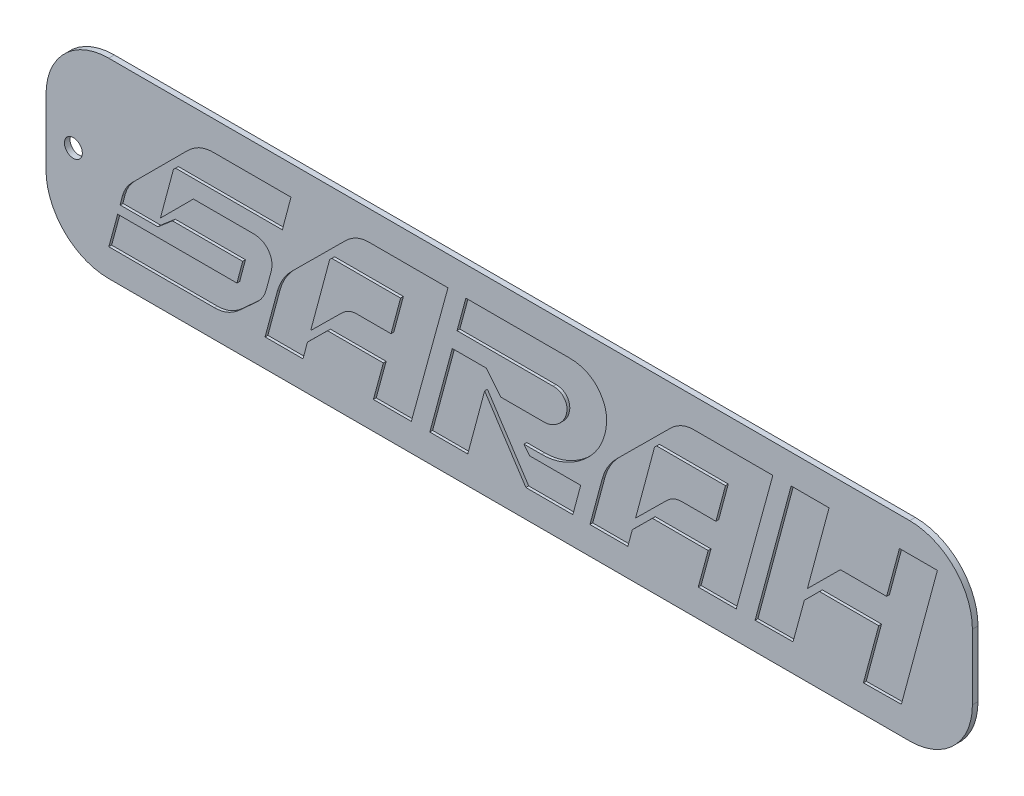
from build123d import *

# Parameters (mm, degrees)
SKETCH1_R           = 5.08
BOSS_EXTRUDE1_DEPTH = 3.175
CUT_EXTRUDE1_DEPTH  = 1.5875


with BuildPart() as part:
    # Sketch1 → Boss-Extrude1 (new body)
    with BuildSketch(Plane.XY):
        with BuildLine():
            Line((-8.106859286, 92.66093554), (446.032681403, 92.66093554))
            ThreePointArc((446.032681403, 92.66093554), (471.177398542, 82.245652679), (481.592681403, 57.10093554))
            Line((481.592681403, 57.10093554), (481.592681403, 19.985636247))
            ThreePointArc((481.592681403, 19.985636247), (471.177398542, -5.159080892), (446.032681403, -15.574363753))
            Line((446.032681403, -15.574363753), (-8.106859286, -15.574363753))
            ThreePointArc((-8.106859286, -15.574363753), (-33.251576425, -5.159080892), (-43.666859286, 19.985636247))
            Line((-43.666859286, 19.985636247), (-43.666859286, 57.10093554))
            ThreePointArc((-43.666859286, 57.10093554), (-33.251576425, 82.245652679), (-8.106859286, 92.66093554))
        make_face()
        with Locations((-28.147827402, 38.543285894)):
            Circle(SKETCH1_R, mode=Mode.SUBTRACT)
    extrude(amount=BOSS_EXTRUDE1_DEPTH)

    # Sketch2 → Cut-Extrude1 (cut)
    # profile 1 of 5: a face of its own
    with BuildSketch(Plane.XY.offset(3.175)):
        with BuildLine():
            Line((29.787987616, 57.61003096), (28.592693498, 56.414736842))
            Line((28.592693498, 56.414736842), (21.200743034, 28.812879257))
            Line((21.200743034, 28.812879257), (39.900804954, 47.512941176))
            Line((39.900804954, 47.512941176), (73.809411765, 47.512941176))
            add(Edge.make_bspline(
                [(73.809411765, 47.512941176), (74.276696684, 47.501766075), (75.183851137, 47.48007151), (76.50174546, 47.285971092), (77.732350114, 46.976039182), (78.875055153, 46.534991188), (79.924614884, 45.96044611), (80.890215533, 45.267458165), (81.761446059, 44.44107263), (82.529307713, 43.497628674), (83.18041765, 42.464319214), (83.728879869, 41.380361786), (84.101737545, 40.227178597), (84.359316183, 39.026157644), (84.465299782, 37.763754748), (84.430461445, 36.45143263), (84.257305067, 35.086176719), (84.036184999, 34.174162182), (83.922229102, 33.704148607)],
                knots=[0, 0, 0, 0, 1.109102603, 2.153134682, 3.15559003, 4.117330611, 5.053263289, 5.989609858, 6.931896307, 7.89629219, 8.870203132, 9.827825582, 10.772657979, 11.739541594, 12.739287703, 13.772876215, 14.852234947, 16, 16, 16, 16], degree=3))
            Line((83.922229102, 33.704148607), (81.201362229, 23.591331269))
            add(Edge.make_bspline(
                [(81.201362229, 23.591331269), (80.948807094, 22.773977955), (80.44238627, 21.135029938), (79.213300767, 18.835721083), (77.627937742, 16.68308216), (76.329649623, 15.426794211), (75.665263158, 14.783900929)],
                knots=[0, 0, 0, 0, 0.971370715, 1.947782042, 2.949797186, 4, 4, 4, 4], degree=3))
            Line((75.665263158, 14.783900929), (66.102910217, 6.086563467))
            add(Edge.make_bspline(
                [(66.102910217, 6.086563467), (65.560841254, 5.609432536), (64.496417328, 4.672523), (62.783592859, 3.470844922), (61.057698565, 2.411305402), (59.266208972, 1.587695377), (57.453479987, 0.906167515), (55.581781266, 0.462791196), (53.677351872, 0.1626132), (52.389644087, 0.127638347), (51.743653251, 0.110092879)],
                knots=[0, 0, 0, 0, 1.087244962, 2.13494893, 3.148231978, 4.134112956, 5.101176401, 6.060986606, 7.027275522, 8, 8, 8, 8], degree=3))
            Line((51.743653251, 0.110092879), (-8.036780186, 0.110092879))
            Line((-8.036780186, 0.110092879), (-3.035417957, 18.58996904))
            Line((-3.035417957, 18.58996904), (64.577337461, 18.58996904))
            Line((64.577337461, 18.58996904), (67.832941176, 30.873188854))
            Line((67.832941176, 30.873188854), (28.042229102, 30.873188854))
            Line((28.042229102, 30.873188854), (19.785263158, 23.811517028))
            Line((19.785263158, 23.811517028), (-1.635665635, 23.811517028))
            Line((-1.635665635, 23.811517028), (-0.330278638, 28.922972136))
            add(Edge.make_bspline(
                [(-0.330278638, 28.922972136), (-0.06215412, 29.782442048), (0.47671499, 31.509780492), (1.76072826, 33.940333075), (3.352486907, 36.272094833), (4.661439518, 37.663046321), (5.331640867, 38.375232198)],
                knots=[0, 0, 0, 0, 0.968000833, 1.945460836, 2.948048303, 4, 4, 4, 4], degree=3))
            Line((5.331640867, 38.375232198), (36.535108359, 69.57869969))
            add(Edge.make_bspline(
                [(36.535108359, 69.57869969), (37.076053449, 70.098080057), (38.137751895, 71.117454), (39.859750727, 72.431201221), (41.618884683, 73.562705838), (43.428997761, 74.502485662), (45.306639283, 75.207008054), (47.230368657, 75.710962009), (49.199870157, 76.044764426), (50.536522058, 76.074798612), (51.208916409, 76.089907121)],
                knots=[0, 0, 0, 0, 1.090484129, 2.140264008, 3.14544098, 4.131445471, 5.1019832, 6.056773183, 7.022471944, 8, 8, 8, 8], degree=3))
            Line((51.208916409, 76.089907121), (95.230340557, 76.089907121))
            Line((95.230340557, 76.089907121), (90.339071207, 57.61003096))
            Line((90.339071207, 57.61003096), (29.787987616, 57.61003096))
        make_face()
    # profile 2 of 5: a face of its own
    with BuildSketch(Plane.XY.offset(3.175)):
        with BuildLine():
            Line((139.45622291, 76.089907121), (184.248297214, 76.089907121))
            Line((184.248297214, 76.089907121), (163.472198142, 0.110092879))
            Line((163.472198142, 0.110092879), (141.956904025, 0.110092879))
            Line((141.956904025, 0.110092879), (147.603095975, 20.870464396))
            Line((147.603095975, 20.870464396), (115.97498452, 20.870464396))
            Line((115.97498452, 20.870464396), (104.556780186, 9.562352941))
            Line((104.556780186, 9.562352941), (102.056099071, 0.110092879))
            Line((102.056099071, 0.110092879), (80.540804954, 0.110092879))
            Line((80.540804954, 0.110092879), (87.492383901, 25.981919505))
            add(Edge.make_bspline(
                [(87.492383901, 25.981919505), (87.688035338, 26.645371072), (88.079006166, 27.971148241), (88.824916675, 29.910929371), (89.702576211, 31.800461991), (90.737357753, 33.634395292), (91.896945565, 35.421190898), (93.189051588, 37.159516171), (94.630544536, 38.829815678), (95.665268216, 39.895431078), (96.189721362, 40.435541796)],
                knots=[0, 0, 0, 0, 0.972188851, 1.942727767, 2.918792729, 3.89888478, 4.900660299, 5.911935627, 6.941657613, 8, 8, 8, 8], degree=3))
            Line((96.189721362, 40.435541796), (126.197894737, 70.223529412))
            add(Edge.make_bspline(
                [(126.197894737, 70.223529412), (126.693738362, 70.68811599), (127.667249793, 71.600259095), (129.228355243, 72.799594193), (130.839256509, 73.806711452), (132.476815777, 74.649150324), (134.161747858, 75.305189439), (135.893002624, 75.757242357), (137.664989023, 76.032176586), (138.857615621, 76.07061432), (139.45622291, 76.089907121)],
                knots=[0, 0, 0, 0, 1.09520327, 2.15026038, 3.168190723, 4.15492977, 5.115689715, 6.0773418, 7.034972711, 8, 8, 8, 8], degree=3))
        make_face()
        with BuildLine():
            Line((151.959628483, 37.400123839), (157.385634675, 57.61003096))
            Line((157.385634675, 57.61003096), (118.365572755, 57.61003096))
            Line((118.365572755, 57.61003096), (117.170278638, 56.414736842))
            Line((117.170278638, 56.414736842), (106.412631579, 16.199380805))
            Line((106.412631579, 16.199380805), (123.901671827, 33.483962848))
            add(Edge.make_bspline(
                [(123.901671827, 33.483962848), (124.227130622, 33.793484328), (124.866595681, 34.401635574), (125.890867818, 35.204466573), (126.950415514, 35.892296283), (128.047201798, 36.433077589), (129.164570187, 36.874999281), (130.31794362, 37.163848907), (131.501525727, 37.365984392), (132.30456566, 37.388687169), (132.709102167, 37.400123839)],
                knots=[0, 0, 0, 0, 1.088018936, 2.137751703, 3.149265309, 4.143636785, 5.096896491, 6.055307392, 7.020348651, 8, 8, 8, 8], degree=3))
            Line((132.709102167, 37.400123839), (151.959628483, 37.400123839))
        make_face(mode=Mode.SUBTRACT)
    # profile 3 of 5: a face of its own
    with BuildSketch(Plane.XY.offset(3.175)):
        with BuildLine():
            add(Edge.make_bspline(
                [(270.262291022, 68.053126935), (270.731488529, 67.366880996), (271.661761032, 66.00626906), (272.728765108, 63.778867775), (273.519576616, 61.455712397), (274.03233301, 59.021807131), (274.225924849, 56.475326223), (274.140889545, 53.824684264), (273.778705596, 51.062974752), (273.32633654, 49.218328433), (273.093250774, 48.267863777)],
                knots=[0, 0, 0, 0, 0.961877665, 1.907103789, 2.850083582, 3.799378563, 4.780335239, 5.801073342, 6.866990356, 8, 8, 8, 8], degree=3))
            add(Edge.make_bspline(
                [(273.093250774, 48.267863777), (272.812019094, 47.328517157), (272.251608076, 45.456678976), (271.096004488, 42.757827303), (269.736273411, 40.156151552), (268.111017911, 37.680442163), (266.287737707, 35.293817541), (264.210452269, 33.025908899), (261.918190373, 30.854340343), (259.414741337, 28.836012309), (256.803526514, 26.969939526), (254.107174065, 25.358836502), (251.399463109, 23.948270612), (248.636867095, 22.845379686), (245.86295762, 21.94185992), (243.0422029, 21.339803128), (240.197325406, 20.942101185), (238.284256045, 20.894325491), (237.32879257, 20.870464396)],
                knots=[0, 0, 0, 0, 0.97804993, 1.948962355, 2.925064492, 3.904792855, 4.901205012, 5.919903121, 6.971183752, 8.049975335, 9.127306388, 10.171923768, 11.182945394, 12.171203276, 13.137691742, 14.09124472, 15.046691149, 16, 16, 16, 16], degree=3))
            Line((237.32879257, 20.870464396), (227.326068111, 20.870464396))
            Line((227.326068111, 20.870464396), (230.581671827, 16.734117647))
            Line((230.581671827, 16.734117647), (259.504643963, 16.734117647))
            Line((259.504643963, 16.734117647), (255.05374613, 0.110092879))
            Line((255.05374613, 0.110092879), (228.41126935, 0.110092879))
            Line((228.41126935, 0.110092879), (205.040123839, 35.874551084))
            Line((205.040123839, 35.874551084), (195.477770898, 0.110092879))
            Line((195.477770898, 0.110092879), (173.946749226, 0.110092879))
            Line((173.946749226, 0.110092879), (186.670340557, 47.512941176))
            Line((186.670340557, 47.512941176), (205.905139319, 47.512941176))
            Line((205.905139319, 47.512941176), (214.287925697, 37.400123839))
            Line((214.287925697, 37.400123839), (238.634179567, 37.400123839))
            add(Edge.make_bspline(
                [(238.634179567, 37.400123839), (239.319676207, 37.436394395), (240.698288907, 37.509338662), (242.72001145, 38.11136999), (244.686345896, 39.059735067), (246.551967173, 40.351378107), (248.233365396, 41.892526958), (249.655293937, 43.603529672), (250.699823684, 45.485540346), (251.405048398, 47.457155267), (251.767190109, 49.431927622), (251.715318271, 51.327686473), (251.248303493, 53.087542036), (250.38108882, 54.655633883), (249.183616624, 55.973268562), (247.687650674, 56.959900226), (245.900149943, 57.509782064), (244.630078341, 57.575605015), (243.965820433, 57.61003096)],
                knots=[0, 0, 0, 0, 1.024328987, 2.060043575, 3.13039622, 4.281662315, 5.442274921, 6.535335147, 7.596155383, 8.645921005, 9.657215708, 10.583586998, 11.460982792, 12.356435318, 13.239426359, 14.101212219, 15.006918353, 16, 16, 16, 16], degree=3))
            Line((243.965820433, 57.61003096), (189.39120743, 57.61003096))
            Line((189.39120743, 57.61003096), (194.392569659, 76.089907121))
            Line((194.392569659, 76.089907121), (252.867616099, 76.089907121))
            add(Edge.make_bspline(
                [(252.867616099, 76.089907121), (253.791678804, 76.067295423), (255.59026362, 76.023284279), (258.205450914, 75.63650897), (260.654999948, 75.01312084), (262.936291548, 74.134795281), (265.031573774, 72.984393262), (266.970800428, 71.605451252), (268.749931463, 69.970718569), (269.754524809, 68.696947537), (270.262291022, 68.053126935)],
                knots=[0, 0, 0, 0, 1.112653996, 2.165656695, 3.176610271, 4.152371772, 5.101949124, 6.048265736, 7.013506589, 8, 8, 8, 8], degree=3))
        make_face()
    # profile 4 of 5: a face of its own
    with BuildSketch(Plane.XY.offset(3.175)):
        with BuildLine():
            Line((323.657337461, 76.089907121), (368.449411765, 76.089907121))
            Line((368.449411765, 76.089907121), (347.673312693, 0.110092879))
            Line((347.673312693, 0.110092879), (326.158018576, 0.110092879))
            Line((326.158018576, 0.110092879), (331.804210526, 20.870464396))
            Line((331.804210526, 20.870464396), (300.176099071, 20.870464396))
            Line((300.176099071, 20.870464396), (288.757894737, 9.562352941))
            Line((288.757894737, 9.562352941), (286.257213622, 0.110092879))
            Line((286.257213622, 0.110092879), (264.741919505, 0.110092879))
            Line((264.741919505, 0.110092879), (271.693498452, 25.981919505))
            add(Edge.make_bspline(
                [(271.693498452, 25.981919505), (271.889149889, 26.645371072), (272.280120718, 27.971148241), (273.026031226, 29.910929371), (273.903690763, 31.800461991), (274.938472304, 33.634395292), (276.098060116, 35.421190898), (277.39016614, 37.159516171), (278.831659088, 38.829815678), (279.866382767, 39.895431078), (280.390835913, 40.435541796)],
                knots=[0, 0, 0, 0, 0.972188851, 1.942727767, 2.918792729, 3.89888478, 4.900660299, 5.911935627, 6.941657613, 8, 8, 8, 8], degree=3))
            Line((280.390835913, 40.435541796), (310.399009288, 70.223529412))
            add(Edge.make_bspline(
                [(310.399009288, 70.223529412), (310.894852913, 70.68811599), (311.868364344, 71.600259095), (313.429469794, 72.799594193), (315.04037106, 73.806711452), (316.677930328, 74.649150324), (318.362862409, 75.305189439), (320.094117175, 75.757242357), (321.866103574, 76.032176586), (323.058730172, 76.07061432), (323.657337461, 76.089907121)],
                knots=[0, 0, 0, 0, 1.09520327, 2.15026038, 3.168190723, 4.15492977, 5.115689715, 6.0773418, 7.034972711, 8, 8, 8, 8], degree=3))
        make_face()
        with BuildLine():
            Line((336.160743034, 37.400123839), (341.586749226, 57.61003096))
            Line((341.586749226, 57.61003096), (302.566687307, 57.61003096))
            Line((302.566687307, 57.61003096), (301.371393189, 56.414736842))
            Line((301.371393189, 56.414736842), (290.61374613, 16.199380805))
            Line((290.61374613, 16.199380805), (308.102786378, 33.483962848))
            add(Edge.make_bspline(
                [(308.102786378, 33.483962848), (308.428245173, 33.793484328), (309.067710232, 34.401635574), (310.091982369, 35.204466573), (311.151530065, 35.892296283), (312.248316349, 36.433077589), (313.365684738, 36.874999281), (314.519058171, 37.163848907), (315.702640278, 37.365984392), (316.505680211, 37.388687169), (316.910216718, 37.400123839)],
                knots=[0, 0, 0, 0, 1.088018936, 2.137751703, 3.149265309, 4.143636785, 5.096896491, 6.055307392, 7.020348651, 8, 8, 8, 8], degree=3))
            Line((316.910216718, 37.400123839), (336.160743034, 37.400123839))
        make_face(mode=Mode.SUBTRACT)
    # profile 5 of 5: a face of its own
    with BuildSketch(Plane.XY.offset(3.175)):
        Polygon((440.22996904, 76.089907121), (461.745263158, 76.089907121), (441.315170279, 0.110092879), (419.784148607, -0.110092879), (428.481486068, 32.288668731), (394.903157895, 32.288668731), (386.315913313, 23.701424149), (379.899071207, 0.110092879), (358.368049536, -0.110092879), (378.813869969, 76.089907121), (400.329164087, 76.089907121), (388.045944272, 30.322724458), (406.746006192, 48.912693498), (432.948111455, 48.912693498), align=None)
    extrude(amount=-CUT_EXTRUDE1_DEPTH, mode=Mode.SUBTRACT)


solid = part.part
